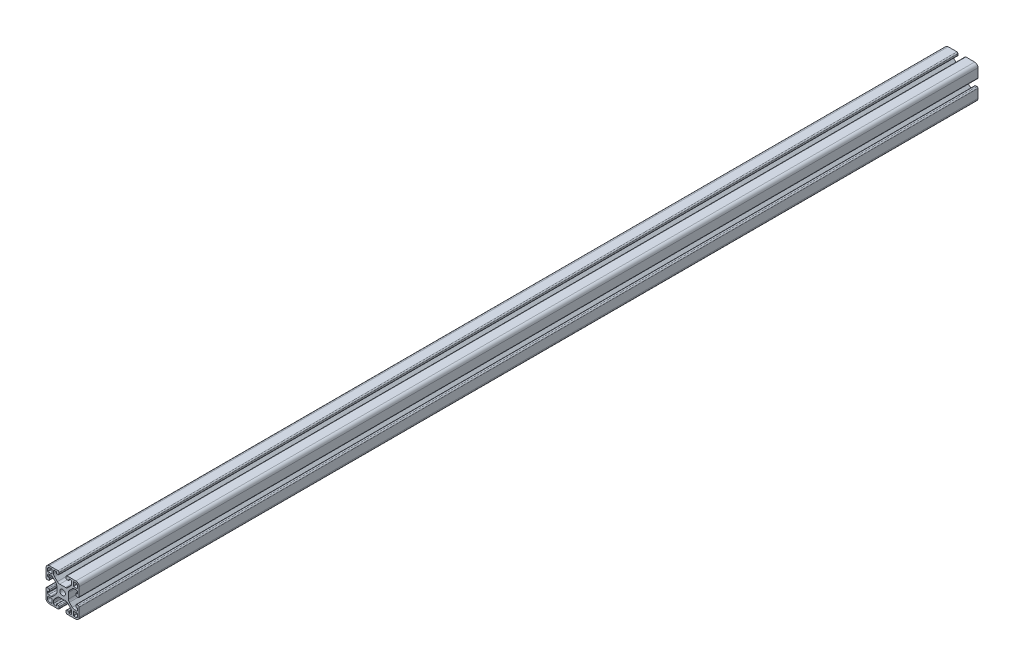
from build123d import *

# Parameters (mm, degrees)
ESQUISSE1_R        = 2.5
BOSS_EXTRU_1_DEPTH = 813


with BuildPart() as part:
    # Esquisse1 → Boss.-Extru.1 (new body)
    with BuildSketch(Plane.XY.offset(20)):
        with BuildLine():
            Line((20.3, 3), (18.9, 3))
            ThreePointArc((18.9, 3), (18.334314575, 2.765685425), (18.1, 2.2))
            Line((18.1, 2.2), (18.1, 1))
            ThreePointArc((18.1, 1), (18.392893219, 0.292893219), (19.1, 0))
            Line((19.1, 0), (27, 0))
            ThreePointArc((27, 0), (29.121320344, 0.878679656), (30, 3))
            Line((30, 3), (30, 10.9))
            ThreePointArc((30, 10.9), (29.707106781, 11.607106781), (29, 11.9))
            Line((29, 11.9), (27.8, 11.9))
            ThreePointArc((27.8, 11.9), (27.234314575, 11.665685425), (27, 11.1))
            Line((27, 11.1), (27, 9.7))
            ThreePointArc((27, 9.7), (27.087867966, 9.487867966), (27.3, 9.4))
            Line((27.3, 9.4), (28.2, 9.4))
            ThreePointArc((28.2, 9.4), (28.412132034, 9.312132034), (28.5, 9.1))
            Line((28.5, 9.1), (28.5, 7.85))
            ThreePointArc((28.5, 7.85), (28.207106781, 7.142893219), (27.5, 6.85))
            Line((27.5, 6.85), (25.806854249, 6.85))
            ThreePointArc((25.806854249, 6.85), (24.658803952, 7.078361402), (23.685533906, 7.728679656))
            Line((23.685533906, 7.728679656), (21.128679656, 10.285533906))
            ThreePointArc((21.128679656, 10.285533906), (20.478361402, 11.258803952), (20.25, 12.406854249))
            Line((20.25, 12.406854249), (20.25, 17.59314575))
            ThreePointArc((20.25, 17.59314575), (20.478361402, 18.741196048), (21.128679656, 19.714466094))
            Line((21.128679656, 19.714466094), (23.685533906, 22.271320344))
            ThreePointArc((23.685533906, 22.271320344), (24.658803952, 22.921638598), (25.80685425, 23.15))
            Line((25.80685425, 23.15), (27.5, 23.15))
            ThreePointArc((27.5, 23.15), (28.207106781, 22.857106781), (28.5, 22.15))
            Line((28.5, 22.15), (28.5, 20.9))
            ThreePointArc((28.5, 20.9), (28.412132034, 20.687867966), (28.2, 20.6))
            Line((28.2, 20.6), (27.3, 20.6))
            ThreePointArc((27.3, 20.6), (27.087867966, 20.512132034), (27, 20.3))
            Line((27, 20.3), (27, 18.9))
            ThreePointArc((27, 18.9), (27.234314575, 18.334314575), (27.8, 18.1))
            Line((27.8, 18.1), (29, 18.1))
            ThreePointArc((29, 18.1), (29.707106781, 18.392893219), (30, 19.1))
            Line((30, 19.1), (30, 27))
            ThreePointArc((30, 27), (29.121320344, 29.121320344), (27, 30))
            Line((27, 30), (19.1, 30))
            ThreePointArc((19.1, 30), (18.392893219, 29.707106781), (18.1, 29))
            Line((18.1, 29), (18.1, 27.8))
            ThreePointArc((18.1, 27.8), (18.334314575, 27.234314575), (18.9, 27))
            Line((18.9, 27), (20.3, 27))
            ThreePointArc((20.3, 27), (20.512132034, 27.087867966), (20.6, 27.3))
            Line((20.6, 27.3), (20.6, 28.2))
            ThreePointArc((20.6, 28.2), (20.687867966, 28.412132034), (20.9, 28.5))
            Line((20.9, 28.5), (22.15, 28.5))
            ThreePointArc((22.15, 28.5), (22.857106781, 28.207106781), (23.15, 27.5))
            Line((23.15, 27.5), (23.15, 25.806854249))
            ThreePointArc((23.15, 25.806854249), (22.921638598, 24.658803952), (22.271320344, 23.685533906))
            Line((22.271320344, 23.685533906), (19.714466094, 21.128679656))
            ThreePointArc((19.714466094, 21.128679656), (18.741196048, 20.478361402), (17.59314575, 20.25))
            Line((17.59314575, 20.25), (12.406854249, 20.25))
            ThreePointArc((12.406854249, 20.25), (11.258803952, 20.478361402), (10.285533906, 21.128679656))
            Line((10.285533906, 21.128679656), (7.728679656, 23.685533906))
            ThreePointArc((7.728679656, 23.685533906), (7.078361402, 24.658803952), (6.85, 25.806854249))
            Line((6.85, 25.806854249), (6.85, 27.5))
            ThreePointArc((6.85, 27.5), (7.142893219, 28.207106781), (7.85, 28.5))
            Line((7.85, 28.5), (9.1, 28.5))
            ThreePointArc((9.1, 28.5), (9.312132034, 28.412132034), (9.4, 28.2))
            Line((9.4, 28.2), (9.4, 27.3))
            ThreePointArc((9.4, 27.3), (9.487867966, 27.087867966), (9.7, 27))
            Line((9.7, 27), (11.1, 27))
            ThreePointArc((11.1, 27), (11.665685425, 27.234314575), (11.9, 27.8))
            Line((11.9, 27.8), (11.9, 29))
            ThreePointArc((11.9, 29), (11.607106781, 29.707106781), (10.9, 30))
            Line((10.9, 30), (3, 30))
            ThreePointArc((3, 30), (0.878679656, 29.121320344), (0, 27))
            Line((0, 27), (0, 19.1))
            ThreePointArc((0, 19.1), (0.292893219, 18.392893219), (1, 18.1))
            Line((1, 18.1), (2.2, 18.1))
            ThreePointArc((2.2, 18.1), (2.765685425, 18.334314575), (3, 18.9))
            Line((3, 18.9), (3, 20.3))
            ThreePointArc((3, 20.3), (2.912132034, 20.512132034), (2.7, 20.6))
            Line((2.7, 20.6), (1.8, 20.6))
            ThreePointArc((1.8, 20.6), (1.587867966, 20.687867966), (1.5, 20.9))
            Line((1.5, 20.9), (1.5, 22.15))
            ThreePointArc((1.5, 22.15), (1.792893219, 22.857106781), (2.5, 23.15))
            Line((2.5, 23.15), (4.19314575, 23.15))
            ThreePointArc((4.19314575, 23.15), (5.341196048, 22.921638598), (6.314466094, 22.271320344))
            Line((6.314466094, 22.271320344), (8.871320344, 19.714466094))
            ThreePointArc((8.871320344, 19.714466094), (9.521638598, 18.741196048), (9.75, 17.593145751))
            Line((9.75, 17.593145751), (9.75, 12.406854249))
            ThreePointArc((9.75, 12.406854249), (9.521638598, 11.258803952), (8.871320344, 10.285533906))
            Line((8.871320344, 10.285533906), (6.314466094, 7.728679656))
            ThreePointArc((6.314466094, 7.728679656), (5.341196048, 7.078361402), (4.19314575, 6.85))
            Line((4.19314575, 6.85), (2.5, 6.85))
            ThreePointArc((2.5, 6.85), (1.792893219, 7.142893219), (1.5, 7.85))
            Line((1.5, 7.85), (1.5, 9.1))
            ThreePointArc((1.5, 9.1), (1.587867966, 9.312132034), (1.8, 9.4))
            Line((1.8, 9.4), (2.7, 9.4))
            ThreePointArc((2.7, 9.4), (2.912132034, 9.487867966), (3, 9.7))
            Line((3, 9.7), (3, 11.1))
            ThreePointArc((3, 11.1), (2.765685425, 11.665685425), (2.2, 11.9))
            Line((2.2, 11.9), (1, 11.9))
            ThreePointArc((1, 11.9), (0.292893219, 11.607106781), (0, 10.9))
            Line((0, 10.9), (0, 3))
            ThreePointArc((0, 3), (0.878679656, 0.878679656), (3, 0))
            Line((3, 0), (10.9, 0))
            ThreePointArc((10.9, 0), (11.607106781, 0.292893219), (11.9, 1))
            Line((11.9, 1), (11.9, 2.2))
            ThreePointArc((11.9, 2.2), (11.665685425, 2.765685425), (11.1, 3))
            Line((11.1, 3), (9.7, 3))
            ThreePointArc((9.7, 3), (9.487867966, 2.912132034), (9.4, 2.7))
            Line((9.4, 2.7), (9.4, 1.8))
            ThreePointArc((9.4, 1.8), (9.312132034, 1.587867966), (9.1, 1.5))
            Line((9.1, 1.5), (7.85, 1.5))
            ThreePointArc((7.85, 1.5), (7.142893219, 1.792893219), (6.85, 2.5))
            Line((6.85, 2.5), (6.85, 4.19314575))
            ThreePointArc((6.85, 4.19314575), (7.078361402, 5.341196048), (7.728679656, 6.314466094))
            Line((7.728679656, 6.314466094), (10.285533906, 8.871320344))
            ThreePointArc((10.285533906, 8.871320344), (11.258803952, 9.521638598), (12.406854249, 9.75))
            Line((12.406854249, 9.75), (17.593145751, 9.75))
            ThreePointArc((17.593145751, 9.75), (18.741196048, 9.521638598), (19.714466094, 8.871320344))
            Line((19.714466094, 8.871320344), (22.271320344, 6.314466094))
            ThreePointArc((22.271320344, 6.314466094), (22.921638598, 5.341196048), (23.15, 4.193145751))
            Line((23.15, 4.193145751), (23.15, 2.5))
            ThreePointArc((23.15, 2.5), (22.857106781, 1.792893219), (22.15, 1.5))
            Line((22.15, 1.5), (20.9, 1.5))
            ThreePointArc((20.9, 1.5), (20.687867966, 1.587867966), (20.6, 1.8))
            Line((20.6, 1.8), (20.6, 2.7))
            ThreePointArc((20.6, 2.7), (20.512132034, 2.912132034), (20.3, 3))
        make_face()
        with Locations((15, 15)):
            Circle(ESQUISSE1_R, mode=Mode.SUBTRACT)
        with BuildLine():
            Line((5.35, 5.05), (5.35, 1.8))
            ThreePointArc((5.35, 1.8), (5.262132034, 1.587867966), (5.05, 1.5))
            Line((5.05, 1.5), (3, 1.5))
            ThreePointArc((3, 1.5), (1.939339828, 1.939339828), (1.5, 3))
            Line((1.5, 3), (1.5, 5.05))
            ThreePointArc((1.5, 5.05), (1.587867966, 5.262132034), (1.8, 5.35))
            Line((1.8, 5.35), (5.05, 5.35))
            ThreePointArc((5.05, 5.35), (5.262132034, 5.262132034), (5.35, 5.05))
        make_face(mode=Mode.SUBTRACT)
        with BuildLine():
            Line((24.95, 5.35), (28.2, 5.35))
            ThreePointArc((28.2, 5.35), (28.412132034, 5.262132034), (28.5, 5.05))
            Line((28.5, 5.05), (28.5, 3))
            ThreePointArc((28.5, 3), (28.060660172, 1.939339828), (27, 1.5))
            Line((27, 1.5), (24.95, 1.5))
            ThreePointArc((24.95, 1.5), (24.737867966, 1.587867966), (24.65, 1.8))
            Line((24.65, 1.8), (24.65, 5.05))
            ThreePointArc((24.65, 5.05), (24.737867966, 5.262132034), (24.95, 5.35))
        make_face(mode=Mode.SUBTRACT)
        with BuildLine():
            Line((24.65, 24.95), (24.65, 28.2))
            ThreePointArc((24.65, 28.2), (24.737867966, 28.412132034), (24.95, 28.5))
            Line((24.95, 28.5), (27, 28.5))
            ThreePointArc((27, 28.5), (28.060660172, 28.060660172), (28.5, 27))
            Line((28.5, 27), (28.5, 24.95))
            ThreePointArc((28.5, 24.95), (28.412132034, 24.737867966), (28.2, 24.65))
            Line((28.2, 24.65), (24.95, 24.65))
            ThreePointArc((24.95, 24.65), (24.737867966, 24.737867966), (24.65, 24.95))
        make_face(mode=Mode.SUBTRACT)
        with BuildLine():
            Line((5.05, 24.65), (1.8, 24.65))
            ThreePointArc((1.8, 24.65), (1.587867966, 24.737867966), (1.5, 24.95))
            Line((1.5, 24.95), (1.5, 27))
            ThreePointArc((1.5, 27), (1.939339828, 28.060660172), (3, 28.5))
            Line((3, 28.5), (5.05, 28.5))
            ThreePointArc((5.05, 28.5), (5.262132034, 28.412132034), (5.35, 28.2))
            Line((5.35, 28.2), (5.35, 24.95))
            ThreePointArc((5.35, 24.95), (5.262132034, 24.737867966), (5.05, 24.65))
        make_face(mode=Mode.SUBTRACT)
    extrude(amount=-BOSS_EXTRU_1_DEPTH)


solid = part.part
